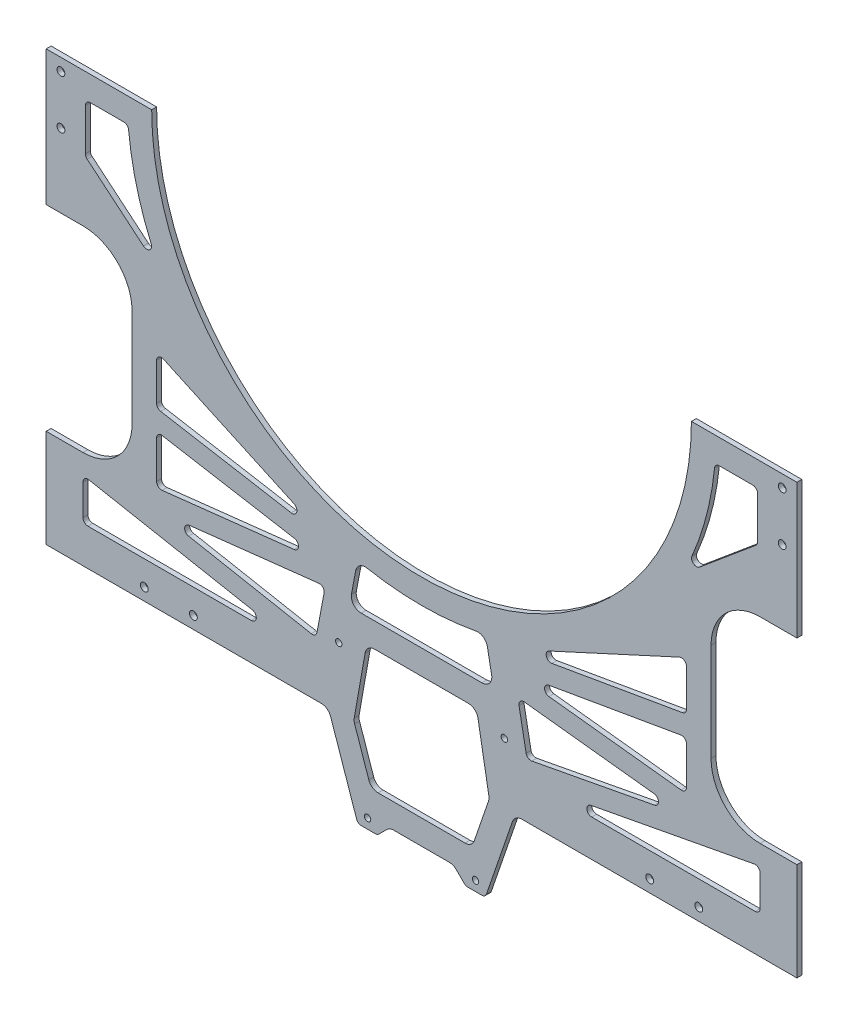
from build123d import *

# Parameters (mm, degrees)
SKETCH_1_W              = 306
SKETCH_1_H              = 175
EXTRUDE_1_DEPTH         = 2
SKETCH_2_R              = 110
SKETCH_2_W              = 35
SKETCH_2_H              = 80
CUT_EXTRUDE_1_DEPTH     = 177.264715698
FILLET_1_R              = 20
HOLE_WIZARD_3_2_3_2_1_D = 3.2
SKETCH_5_W              = 76
SKETCH_5_H              = 35
EXTRUDE_2_DEPTH         = 2
HOLE_WIZARD_2_6_2_6_1_D = 2.6
CUT_EXTRUDE_2_DEPTH     = 197.008290641
FILLET_2_R              = 2
FILLET_3_R              = 4
CUT_EXTRUDE_3_DEPTH     = 197.008290641
FILLET_4_R              = 2
FILLET_4_OF_MIRROR_2_R  = 2
CUT_EXTRUDE_4_DEPTH     = 197.008290641
FILLET_5_R              = 4
HOLE_WIZARD_3_2_3_2_2_D = 3.2
CUT_EXTRUDE_5_DEPTH     = 197.008290641
FILLET_7_R              = 2
FILLET_7_OF_MIRROR_4_R  = 2


with BuildPart() as part:
    # 草图1 → 凸台-拉伸1 (new body)
    with BuildSketch(Plane.XY):
        Rectangle(SKETCH_1_W, SKETCH_1_H)
    extrude(amount=EXTRUDE_1_DEPTH)

    # 草图2 → 切除-拉伸1 (cut, through all)
    with BuildSketch(Plane.XY.offset(2)):
        with Locations((0, 87.5)):
            Circle(SKETCH_2_R)
        with Locations((-135.5, -7.5)):
            Rectangle(SKETCH_2_W, SKETCH_2_H)
        with Locations((135.5, -7.5)):
            Rectangle(SKETCH_2_W, SKETCH_2_H)
    extrude(amount=-CUT_EXTRUDE_1_DEPTH, mode=Mode.SUBTRACT)

    # 圆角1
    fillet_1_edges = [part.edges().sort_by_distance(p)[0] for p in [
        (118, -47.5, 1),
        (118, 32.5, 1),
        (-118, 32.5, 1),
        (-118, -47.5, 1),
    ]]
    fillet(fillet_1_edges, radius=FILLET_1_R)

    # Ø3.2 (3.2) 直径孔1 (through all)
    with Locations(Plane(origin=(113, -82.5, 2), x_dir=(1, 0, 0), z_dir=(0, 0, 1))):
        with Locations((0, 0), (-20, 0)):
            hole_wizard_3_2_3_2_1 = Hole(HOLE_WIZARD_3_2_3_2_1_D / 2)

    # 镜向1: Ø3.2 (3.2) 直径孔1 across plane
    add(hole_wizard_3_2_3_2_1.mirror(Plane(origin=(0, 0, 0), x_dir=(0, 0, 1), z_dir=(1, 0, 0))), mode=Mode.SUBTRACT)

    # 草图5 → 凸台-拉伸2 (add)
    with BuildSketch(Plane.XY.offset(2)):
        with Locations((0, -105)):
            Rectangle(SKETCH_5_W, SKETCH_5_H)
    extrude(amount=-EXTRUDE_2_DEPTH)

    # Ø2.6 (2.6) 直径孔1 (through all)
    with Locations(Plane(origin=(-33.75, -62.5, 2), x_dir=(1, 0, 0), z_dir=(0, 0, 1))):
        with Locations((0, 0), (67.5, 0), (11.75, -56), (55.75, -56)):
            Hole(HOLE_WIZARD_2_6_2_6_1_D / 2)

    # 草图8 → 切除-拉伸2 (cut, through all)
    with BuildSketch(Plane.XY.offset(2)):
        Polygon((38, -122.5), (26, -122.5), (38, -87.5), align=None)
        Polygon((-38, -87.5), (-26, -122.5), (-38, -122.5), align=None)
        Polygon((-18, -122.5), (-13, -117.5), (13, -117.5), (18, -122.5), align=None)
    extrude(amount=-CUT_EXTRUDE_2_DEPTH, mode=Mode.SUBTRACT)

    # 圆角2
    fillet_2_edges = [part.edges().sort_by_distance(p)[0] for p in [
        (26, -122.5, 1),
        (-26, -122.5, 1),
        (18, -122.5, 1),
        (-18, -122.5, 1),
    ]]
    fillet(fillet_2_edges, radius=FILLET_2_R)

    # 圆角3
    fillet_3_edges = [part.edges().sort_by_distance(p)[0] for p in [
        (-38, -87.5, 1),
        (38, -87.5, 1),
        (-13, -117.5, 1),
        (13, -117.5, 1),
    ]]
    fillet(fillet_3_edges, radius=FILLET_3_R)

    # 草图9 → 切除-拉伸3 (cut, through all)
    with BuildSketch(Plane.XY.offset(2)):
        Polygon((-138, -55.5), (-138, -72.5), (-48, -72.5), align=None)
        with BuildLine():
            Line((-21.498069498, -104.797297297), (-27.279305729, -87.93535829))
            ThreePointArc((-27.279305729, -87.93535829), (-27.483396797, -86.949275011), (-27.434752957, -85.943468283))
            Line((-27.434752957, -85.943468283), (-23.002234561, -60.805407289))
            ThreePointArc((-23.002234561, -60.805407289), (-21.634153988, -58.435822228), (-19.063003549, -57.5))
            Line((-19.063003549, -57.5), (19.063003549, -57.5))
            ThreePointArc((19.063003549, -57.5), (21.634153988, -58.435822228), (23.002234561, -60.805407289))
            Line((23.002234561, -60.805407289), (27.434752957, -85.943468283))
            ThreePointArc((27.434752957, -85.943468283), (27.483396797, -86.949275011), (27.279305729, -87.93535829))
            Line((27.279305729, -87.93535829), (21.498069498, -104.797297297))
            ThreePointArc((21.498069498, -104.797297297), (20.039238489, -106.754933885), (17.714285714, -107.5))
            Line((17.714285714, -107.5), (-17.714285714, -107.5))
            ThreePointArc((-17.714285714, -107.5), (-20.039238489, -106.754933885), (-21.498069498, -104.797297297))
        make_face()
        Polygon((-108, -53.025201394), (-43, -65.302979172), (-39.222222222, -45.302979172), align=None)
        Polygon((-108, -24.974934041), (-108, -44.974934041), (-38, -37.115483314), align=None)
        Polygon((-108, 3.144495264), (-108, -16.855504736), (-38, -28.996054009), align=None)
    cut_extrude_3 = extrude(amount=-CUT_EXTRUDE_3_DEPTH, mode=Mode.SUBTRACT)

    # 圆角4
    fillet_4_edges = [part.edges().sort_by_distance(p)[0] for p in [
        (-108, -24.974934041, 1),
        (-38, -37.115483314, 1),
        (-108, -44.974934041, 1),
        (-108, 3.144495264, 1),
        (-38, -28.996054009, 1),
        (-108, -16.855504736, 1),
        (-108, -53.025201394, 1),
        (-39.222222222, -45.302979172, 1),
        (-43, -65.302979172, 1),
        (-138, -55.5, 1),
        (-48, -72.5, 1),
        (-138, -72.5, 1),
    ]]
    fillet(fillet_4_edges, radius=FILLET_4_R)

    # 镜向2: 切除-拉伸3 across plane
    add(cut_extrude_3.mirror(Plane(origin=(0, 0, 0), x_dir=(0, 0, 1), z_dir=(1, 0, 0))), mode=Mode.SUBTRACT)

    # 圆角4 of 镜向2
    fillet_4_of_mirror_2_edges = [part.edges().sort_by_distance(p)[0] for p in [
        (108, -24.974934041, 1),
        (38, -37.115483314, 1),
        (108, -44.974934041, 1),
        (108, 3.144495264, 1),
        (38, -28.996054009, 1),
        (108, -16.855504736, 1),
        (108, -53.025201394, 1),
        (39.222222222, -45.302979172, 1),
        (43, -65.302979172, 1),
        (138, -55.5, 1),
        (48, -72.5, 1),
        (138, -72.5, 1),
    ]]
    fillet(fillet_4_of_mirror_2_edges, radius=FILLET_4_OF_MIRROR_2_R)

    # 草图10 → 切除-拉伸4 (cut, through all)
    with BuildSketch(Plane.XY.offset(2)):
        with BuildLine():
            Line((-29.460383454, -47.5), (-26.085046608, -29.630569637))
            ThreePointArc((-26.085046608, -29.630569637), (0, -32.5), (26.085046608, -29.630569637))
            Line((26.085046608, -29.630569637), (29.460383454, -47.5))
            Line((29.460383454, -47.5), (-29.460383454, -47.5))
        make_face()
    extrude(amount=-CUT_EXTRUDE_4_DEPTH, mode=Mode.SUBTRACT)

    # 圆角5
    fillet_5_edges = [part.edges().sort_by_distance(p)[0] for p in [
        (29.460383454, -47.5, 1),
        (-29.460383454, -47.5, 1),
        (-26.085046608, -29.630569637, 1),
        (26.085046608, -29.630569637, 1),
    ]]
    fillet(fillet_5_edges, radius=FILLET_5_R)

    # Ø3.2 (3.2) 直径孔2 (through all)
    with Locations(Plane(origin=(147, 82.5, 2), x_dir=(1, 0, 0), z_dir=(0, 0, 1))):
        with Locations((0, 0), (0, -20)):
            hole_wizard_3_2_3_2_2 = Hole(HOLE_WIZARD_3_2_3_2_2_D / 2)

    # 镜向3: Ø3.2 (3.2) 直径孔2 across plane
    add(hole_wizard_3_2_3_2_2.mirror(Plane(origin=(0, 0, 0), x_dir=(0, 0, 1), z_dir=(1, 0, 0))), mode=Mode.SUBTRACT)

    # 草图13 → 切除-拉伸5 (cut, through all)
    with BuildSketch(Plane.XY.offset(2)):
        with BuildLine():
            Line((-137, 77.5), (-119.582607431, 77.5))
            ThreePointArc((-119.582607431, 77.5), (-115.231385377, 54.007794577), (-106.312384413, 31.843222151))
            Line((-106.312384413, 31.843222151), (-137, 57.5))
            Line((-137, 57.5), (-137, 77.5))
        make_face()
    cut_extrude_5 = extrude(amount=-CUT_EXTRUDE_5_DEPTH, mode=Mode.SUBTRACT)

    # 圆角7
    fillet_7_edges = [part.edges().sort_by_distance(p)[0] for p in [
        (-137, 57.5, 1),
        (-137, 77.5, 1),
        (-119.582607431, 77.5, 1),
        (-106.312384413, 31.843222151, 1),
    ]]
    fillet(fillet_7_edges, radius=FILLET_7_R)

    # 镜向4: 切除-拉伸5 across plane
    add(cut_extrude_5.mirror(Plane(origin=(0, 0, 0), x_dir=(0, 0, 1), z_dir=(1, 0, 0))), mode=Mode.SUBTRACT)

    # 圆角7 of 镜向4
    fillet_7_of_mirror_4_edges = [part.edges().sort_by_distance(p)[0] for p in [
        (137, 57.5, 1),
        (137, 77.5, 1),
        (119.582607431, 77.5, 1),
        (106.312384413, 31.843222151, 1),
    ]]
    fillet(fillet_7_of_mirror_4_edges, radius=FILLET_7_OF_MIRROR_4_R)


solid = part.part
